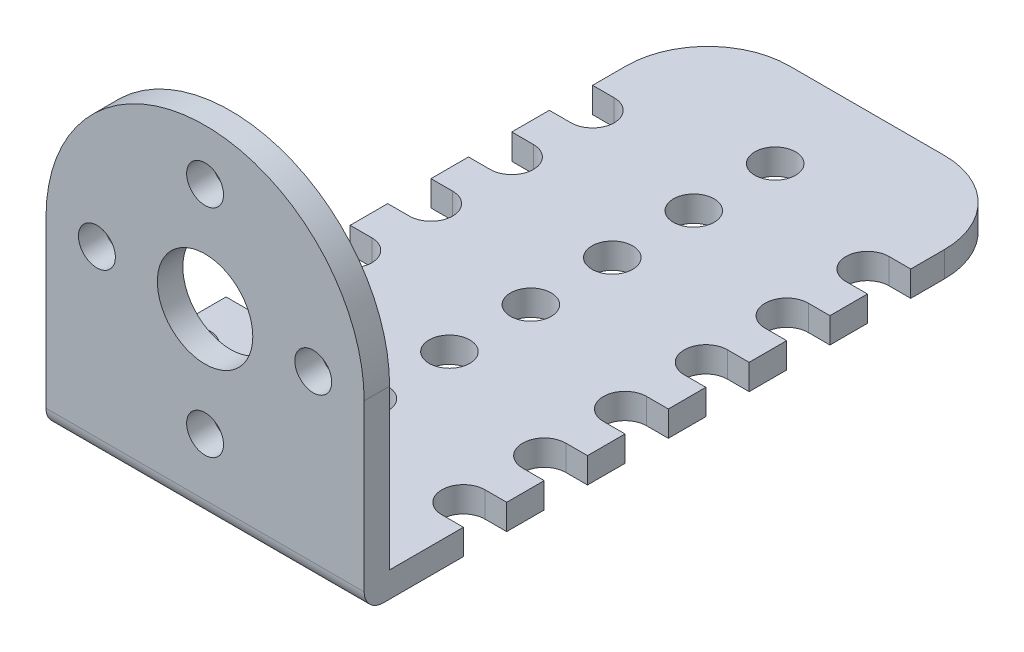
from build123d import *

# Parameters (mm, degrees)
BOSS_EXTRUDE1_DEPTH = 12.5
FILLET1_R           = 1.5
SKETCH3_R           = 1.45
SKETCH3_R_2         = 3.75
CUT_EXTRUDE1_DEPTH  = 60.036005962
SKETCH5_R           = 1.6
CUT_EXTRUDE2_DEPTH  = 59.182901268
CUT_EXTRUDE3_DEPTH  = 59.182901268
FILLET2_R           = 6.4


with BuildPart() as part:
    # Sketch1 → Boss-Extrude1 (new, symmetric)
    with BuildSketch(Plane(origin=(0, 0, 0), x_dir=(0, 0, -1), z_dir=(1, 0, 0))):
        Polygon((0, 25), (0, 0), (50, 0), (50, -2), (-2, -2), (-2, 25), align=None)
    extrude(amount=BOSS_EXTRUDE1_DEPTH, both=True)

    # Fillet1
    fillet1_edges = [part.edges().sort_by_distance(p)[0] for p in [
        (0, -2, 2),
    ]]
    fillet(fillet1_edges, radius=FILLET1_R)

    # Sketch3 → Cut-Extrude1 (cut, through all)
    with BuildSketch(Plane.XY.offset(2)):
        with BuildLine():
            ThreePointArc((-12.5, 12.5), (-8.838834765, 21.338834765), (0, 25))
            Line((0, 25), (-12.5, 25))
            Line((-12.5, 25), (-12.5, 12.5))
        make_face()
        with BuildLine():
            ThreePointArc((0, 25), (8.838834765, 21.338834765), (12.5, 12.5))
            Line((12.5, 12.5), (12.5, 25))
            Line((12.5, 25), (0, 25))
        make_face()
        with Locations((0, 21)):
            Circle(SKETCH3_R)
        with Locations((0, 12.5)):
            Circle(SKETCH3_R_2)
        with Locations((-8.5, 12.5)):
            Circle(SKETCH3_R)
        with Locations((0, 4)):
            Circle(SKETCH3_R)
        with Locations((8.5, 12.5)):
            Circle(SKETCH3_R)
    extrude(amount=-CUT_EXTRUDE1_DEPTH, mode=Mode.SUBTRACT)

    # Sketch5 → Cut-Extrude2 (cut, through all)
    with BuildSketch(Plane.XZ.offset(2)):
        with Locations(Location((0, -42.8, 0), (0, 0, 270))):
            Circle(SKETCH5_R)
        with Locations(Location((0, -36.4, 0), (0, 0, 270))):
            Circle(SKETCH5_R)
        with Locations(Location((0, -30, 0), (0, 0, 270))):
            Circle(SKETCH5_R)
        with Locations(Location((0, -23.6, 0), (0, 0, 270))):
            Circle(SKETCH5_R)
        with Locations(Location((0, -17.2, 0), (0, 0, 270))):
            Circle(SKETCH5_R)
        with Locations(Location((0, -10.8, 0), (0, 0, 270))):
            Circle(SKETCH5_R)
        with Locations(Location((0, -4.4, 0), (0, 0, 270))):
            Circle(SKETCH5_R)
    extrude(amount=-CUT_EXTRUDE2_DEPTH, mode=Mode.SUBTRACT)

    # Sketch6 → Cut-Extrude3 (cut, through all)
    with BuildSketch(Plane.XZ.offset(2)):
        with BuildLine():
            Line((12.5, -40.95), (12.5, -37.55))
            Line((12.5, -37.55), (10.8, -37.55))
            ThreePointArc((10.8, -37.55), (9.1, -39.25), (10.8, -40.95))
            Line((10.8, -40.95), (12.5, -40.95))
        make_face()
        with BuildLine():
            Line((10.8, -34.6), (12.5, -34.6))
            Line((12.5, -34.6), (12.5, -31.2))
            Line((12.5, -31.2), (10.8, -31.2))
            ThreePointArc((10.8, -31.2), (9.1, -32.9), (10.8, -34.6))
        make_face()
        with BuildLine():
            Line((12.5, -5.8), (10.8, -5.8))
            ThreePointArc((10.8, -5.8), (9.1, -7.5), (10.8, -9.2))
            Line((10.8, -9.2), (12.5, -9.2))
            Line((12.5, -9.2), (12.5, -5.8))
        make_face()
        with BuildLine():
            Line((10.8, -28.25), (12.5, -28.25))
            Line((12.5, -28.25), (12.5, -24.85))
            Line((12.5, -24.85), (10.8, -24.85))
            ThreePointArc((10.8, -24.85), (9.1, -26.55), (10.8, -28.25))
        make_face()
        with BuildLine():
            Line((12.5, -12.15), (10.8, -12.15))
            ThreePointArc((10.8, -12.15), (9.1, -13.85), (10.8, -15.55))
            Line((10.8, -15.55), (12.5, -15.55))
            Line((12.5, -15.55), (12.5, -12.15))
        make_face()
        with BuildLine():
            Line((10.8, -21.9), (12.5, -21.9))
            Line((12.5, -21.9), (12.5, -18.5))
            Line((12.5, -18.5), (10.8, -18.5))
            ThreePointArc((10.8, -18.5), (9.1, -20.2), (10.8, -21.9))
        make_face()
    cut_extrude3 = extrude(amount=-CUT_EXTRUDE3_DEPTH, mode=Mode.SUBTRACT)

    # Mirror1: Cut-Extrude3 across plane
    add(cut_extrude3.mirror(Plane(origin=(0, 0, 0), x_dir=(0, 0, 1), z_dir=(1, 0, 0))), mode=Mode.SUBTRACT)

    # Fillet2
    fillet2_edges = [part.edges().sort_by_distance(p)[0] for p in [
        (12.5, -1, -50),
        (-12.5, -1, -50),
    ]]
    fillet(fillet2_edges, radius=FILLET2_R)


solid = part.part
